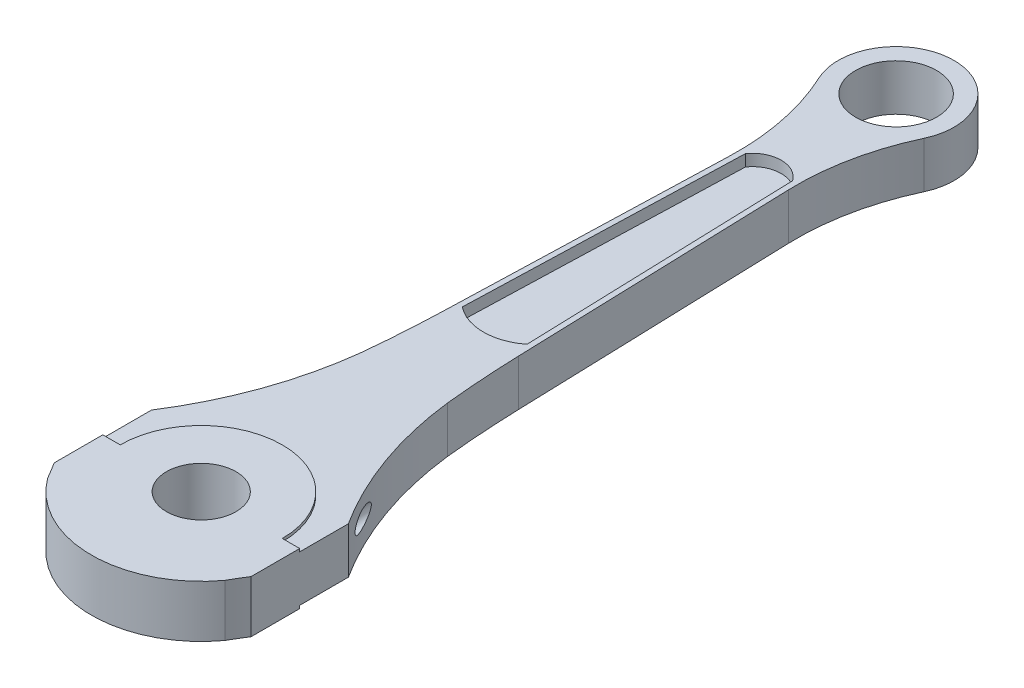
from build123d import *
from build123d.topology import SkipClean

# Parameters (mm, degrees)
SKETCH_1_R               = 5
SKETCH_1_R_2             = 3.5
EXTRUDE_1_DEPTH          = 2
EXTRUDE_2_DEPTH          = 2
CUT_EXTRUDE_1_DEPTH      = 61.539243471
CUT_EXTRUDE_1_DEPTH_BACK = 61.539243471
EXTRUDE_3_DEPTH          = 0.25
EXTRUDE_4_DEPTH          = 2
CUT_EXTRUDE_START        = 1
CUT_EXTRUDE_2_DEPTH      = 63.641007782
CUT_EXTRUDE_3_DEPTH      = 61.641007782
CUT_EXTRUDE_3_DEPTH_BACK = 61.641007782
SKETCH_8_R               = 0.706141664
EXTRUDE_5_DEPTH          = 4.5


with BuildPart() as part:
    # 草图1 → 凸台-拉伸1 (new, symmetric)
    with BuildSketch(Plane(origin=(0, 0, 0), x_dir=(1, 0, 0), z_dir=(0, 1, 0))):
        with Locations(Location((0, 0, 0), (0, 0, 270))):
            Circle(SKETCH_1_R)
        with Locations(Location((0, 0, 0), (0, 0, 270))):
            Circle(SKETCH_1_R_2, mode=Mode.SUBTRACT)
    extrude(amount=EXTRUDE_1_DEPTH, both=True)

    # 草图3 → 凸台-拉伸2 (add, symmetric)
    with BuildSketch(Plane(origin=(0, 0, 0), x_dir=(1, 0, 0), z_dir=(0, 1, 0))):
        with BuildLine():
            ThreePointArc((-4.530759254, -2.114762536), (-2.959942563, -6.862777701), (-2.534847218, -11.845789545))
            Line((-2.534847218, -11.845789545), (-3.308166283, -35.931035681))
            ThreePointArc((-3.308166283, -35.931035681), (-4.349252604, -47.119849682), (-6.737299363, -58.100316528))
            ThreePointArc((-6.737299363, -58.100316528), (0, -53), (6.737299363, -58.100316528))
            ThreePointArc((6.737299363, -58.100316528), (4.349252604, -47.119849682), (3.308166283, -35.931035681))
            Line((3.308166283, -35.931035681), (2.534847218, -11.845789545))
            ThreePointArc((2.534847218, -11.845789545), (2.959942563, -6.862777701), (4.530759254, -2.114762536))
            ThreePointArc((4.530759254, -2.114762536), (0, -5), (-4.530759254, -2.114762536))
        make_face()
        with BuildLine():
            Line((-7, -60), (7, -60))
            ThreePointArc((7, -60), (0, -53), (-7, -60))
        make_face()
    extrude(amount=EXTRUDE_2_DEPTH, both=True)

    # 草图4 → 切除-拉伸1 (cut, two sides: drawn at the far end of the back side and taken through both)
    with BuildSketch(Plane(origin=(0, 2, 0), x_dir=(1, 0, 0), z_dir=(0, 1, 0)).offset(-CUT_EXTRUDE_1_DEPTH_BACK)):
        with BuildLine():
            Line((-3, -60), (3, -60))
            ThreePointArc((3, -60), (0, -57), (-3, -60))
        make_face()
    extrude(amount=CUT_EXTRUDE_1_DEPTH + CUT_EXTRUDE_1_DEPTH_BACK, mode=Mode.SUBTRACT)

    # 草图5 → 凸台-拉伸3 (add, symmetric)
    with SkipClean():  # the faces are left unmerged after this step: merging them gives an invalid solid
        with BuildSketch(Plane(origin=(0, 2, 0), x_dir=(1, 0, 0), z_dir=(0, 1, 0))):
            with BuildLine():
                Line((-3, -60), (-7, -60))
                ThreePointArc((-7, -60), (0, -53), (7, -60))
                Line((7, -60), (3, -60))
                ThreePointArc((3, -60), (0, -57), (-3, -60))
            make_face()
        extrude_3 = extrude(amount=EXTRUDE_3_DEPTH, both=True)

    # 镜向1: 凸台-拉伸3 across plane
    with SkipClean():  # the faces are left unmerged after this step: merging them gives an invalid solid
        add(extrude_3.mirror(Plane.ZX))

    # 草图6 → 凸台-拉伸4 (add, symmetric)
    with BuildSketch(Plane(origin=(0, 0, 0), x_dir=(1, 0, 0), z_dir=(0, 1, 0))):
        with BuildLine():
            Line((-8.501136679, -55.801748406), (-8.501136679, -60))
            Line((-8.501136679, -60), (-7, -60))
            ThreePointArc((-7, -60), (-6.934013828, -59.041119283), (-6.737299363, -58.100316528))
            ThreePointArc((-6.737299363, -58.100316528), (-4.907121304, -50.347633667), (-3.749679969, -42.466391834))
            ThreePointArc((-3.749679969, -42.466391834), (-5.3686221, -49.403716977), (-8.501136679, -55.801748406))
        make_face()
        with BuildLine():
            Line((8.501136679, -60), (7, -60))
            ThreePointArc((7, -60), (6.934013828, -59.041119283), (6.737299363, -58.100316528))
            ThreePointArc((6.737299363, -58.100316528), (4.907121304, -50.347633667), (3.749679969, -42.466391834))
            ThreePointArc((3.749679969, -42.466391834), (5.3686221, -49.403716977), (8.501136679, -55.801748406))
            Line((8.501136679, -55.801748406), (8.501136679, -60))
        make_face()
    extrude(amount=EXTRUDE_4_DEPTH, both=True)

    # 草图7 → 切除-拉伸2 (cut)
    with BuildSketch(Plane(origin=(0, 0, 0), x_dir=(1, 0, 0), z_dir=(0, 1, 0)).offset(CUT_EXTRUDE_START)):
        with BuildLine():
            Line((-2.032181597, -10.971248009), (-2.792905901, -34.66422669))
            ThreePointArc((-2.792905901, -34.66422669), (0, -35.636501302), (2.792905901, -34.66422669))
            Line((2.792905901, -34.66422669), (2.032181597, -10.971248009))
            ThreePointArc((2.032181597, -10.971248009), (0, -9.921815328), (-2.032181597, -10.971248009))
        make_face()
    cut_extrude_2 = extrude(amount=CUT_EXTRUDE_2_DEPTH, mode=Mode.SUBTRACT)

    # 镜向2: 切除-拉伸2 across plane
    add(cut_extrude_2.mirror(Plane.ZX), mode=Mode.SUBTRACT)

    # 草图8 → 切除-拉伸3 (cut, two sides: drawn at the far end of the back side and taken through both)
    with BuildSketch(Plane.XY.offset(-CUT_EXTRUDE_3_DEPTH_BACK)):
        with Locations((-6.917679895, 0.156331749)):
            Circle(SKETCH_8_R)
        with Locations((6.917679895, 0.156331749)):
            Circle(SKETCH_8_R)
    extrude(amount=CUT_EXTRUDE_3_DEPTH + CUT_EXTRUDE_3_DEPTH_BACK, mode=Mode.SUBTRACT)

    # 草图11 → 凸台-拉伸5 (add)
    with BuildSketch(Plane(origin=(0, 2.25, 0), x_dir=(1, 0, 0), z_dir=(0, 1, 0))):
        with BuildLine():
            Line((8.501136679, -64.198251594), (8.501136679, -60))
            Line((8.501136679, -60), (3, -60))
            ThreePointArc((3, -60), (0, -63), (-3, -60))
            Line((-3, -60), (-8.501136679, -60))
            Line((-8.501136679, -60), (-8.501136679, -64.198251594))
            ThreePointArc((-8.501136679, -64.198251594), (-8.066557797, -64.898765683), (-7.650409709, -65.61038325))
            ThreePointArc((-7.650409709, -65.61038325), (0, -69.487105403), (7.650409709, -65.61038325))
            ThreePointArc((7.650409709, -65.61038325), (8.066557797, -64.898765683), (8.501136679, -64.198251594))
        make_face()
    extrude(amount=-EXTRUDE_5_DEPTH)


solid = part.part
